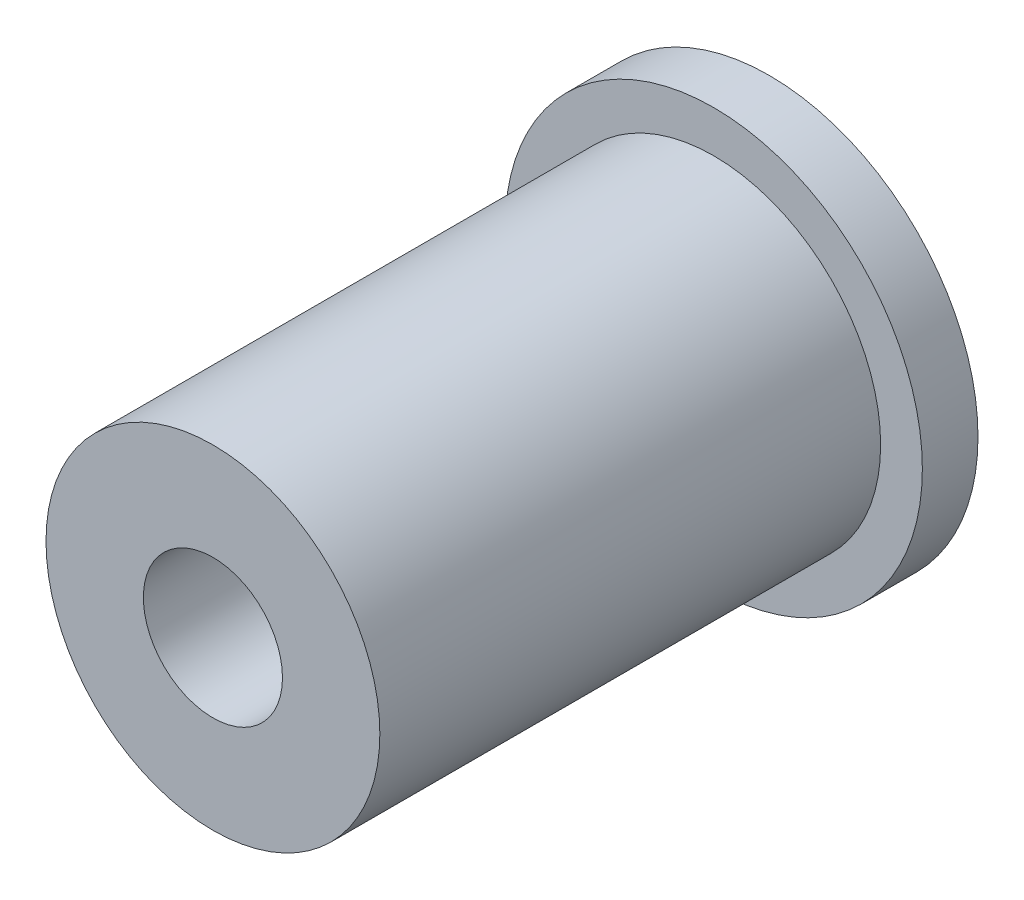
from build123d import *

# Parameters (mm, degrees)
SKETCH1_R           = 7.5
SKETCH1_R_2         = 2.5
BOSS_EXTRUDE1_DEPTH = 2
SKETCH3_R           = 6
SKETCH3_R_2         = 2.5
BOSS_EXTRUDE2_DEPTH = 18


with BuildPart() as part:
    # Sketch1 → Boss-Extrude1 (new body)
    with BuildSketch(Plane.XY):
        Circle(SKETCH1_R)
        Circle(SKETCH1_R_2, mode=Mode.SUBTRACT)
    extrude(amount=BOSS_EXTRUDE1_DEPTH)

    # Sketch3 → Boss-Extrude2 (add)
    with BuildSketch(Plane.XY.offset(2)):
        Circle(SKETCH3_R)
        Circle(SKETCH3_R_2, mode=Mode.SUBTRACT)
    extrude(amount=BOSS_EXTRUDE2_DEPTH)


solid = part.part
